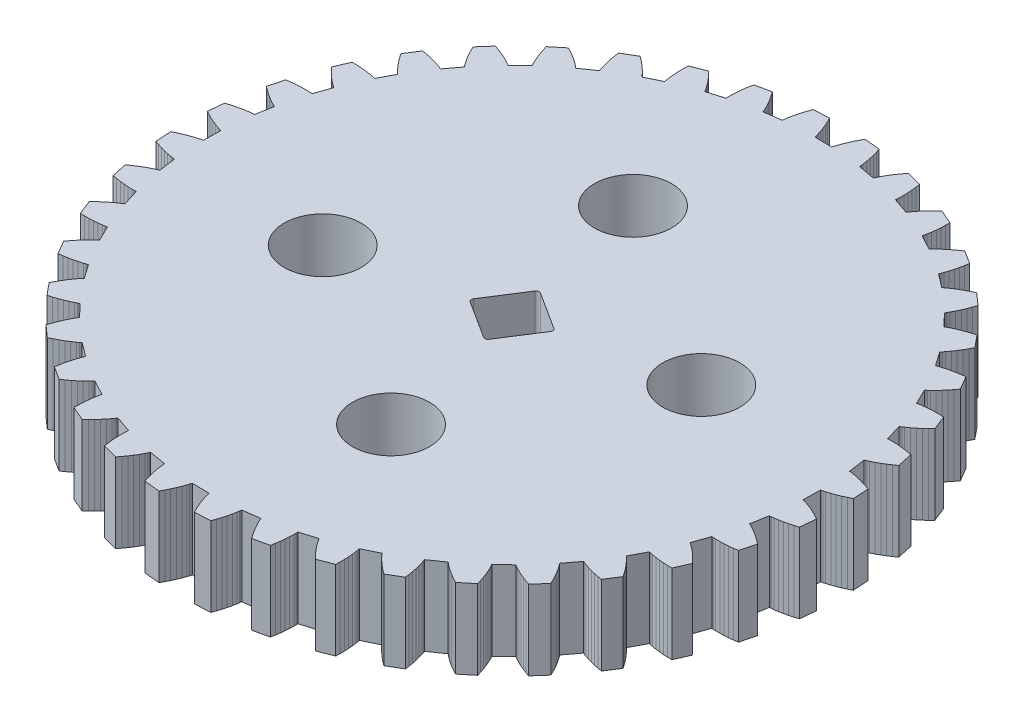
from build123d import *

# Parameters (mm, degrees)
BOSS_EXTRUDE2_DEPTH = 5
SKETCH4_R           = 2.425
CUT_EXTRUDE1_DEPTH  = 59.893978915


with BuildPart() as part:
    # Sketch2 → Boss-Extrude2 (new body)
    with BuildSketch(Plane(origin=(0, 0, 0), x_dir=(1, 0, 0), z_dir=(0, 1, 0))):
        Polygon((1.62446, 18.63357), (1.56046, 18.64093), (1.49637, 18.64925), (1.36792, 18.66858), (1.11018, 18.71715), (0.85152, 18.77769), (0.59219, 18.84922), (0.3324, 18.93102), (0.07232, 19.0226), (0.01335, 20.00933), (0.26067, 20.13123), (0.50888, 20.24339), (0.75784, 20.34529), (1.00744, 20.43621), (1.25757, 20.51513), (1.3828, 20.54962), (1.44545, 20.56552), (1.50812, 20.58044), (1.52832, 21.65214), (1.46626, 21.66942), (1.40425, 21.68766), (1.28042, 21.72685), (1.03344, 21.81514), (0.78744, 21.9154), (0.54249, 22.02661), (0.29869, 22.14805), (0.05614, 22.27918), (0.15226, 23.26299), (0.4156, 23.3447), (0.6783, 23.41666), (0.94014, 23.47835), (1.20089, 23.52911), (1.46029, 23.56792), (1.58937, 23.58241), (1.65373, 23.5883), (1.71796, 23.59324), (1.90557, 24.64858), (1.84697, 24.67536), (1.78859, 24.70308), (1.6724, 24.76116), (1.44228, 24.887), (1.21499, 25.02451), (0.99046, 25.17267), (0.76866, 25.33075), (0.54961, 25.49821), (0.79844, 26.45487), (1.07133, 26.49437), (1.34204, 26.52435), (1.61031, 26.54433), (1.87579, 26.55367), (2.13807, 26.55143), (2.26782, 26.54554), (2.33232, 26.54129), (2.39653, 26.53612), (2.74692, 27.54912), (2.69323, 27.58474), (2.6399, 27.62125), (2.53423, 27.69679), (2.32663, 27.85708), (2.12365, 28.02845), (1.92506, 28.20991), (1.73072, 28.40074), (1.54056, 28.60041), (1.93599, 29.50636), (2.21169, 29.50269), (2.48376, 29.48995), (2.75185, 29.46772), (3.01553, 29.43541), (3.27422, 29.39217), (3.40146, 29.36605), (3.4645, 29.35177), (3.52711, 29.33662), (4.03165, 30.28234), (3.9842, 30.32591), (3.93724, 30.37031), (3.84469, 30.46145), (3.66471, 30.65224), (3.49104, 30.85326), (3.32328, 31.06355), (3.16119, 31.28244), (3.00461, 31.50939), (3.53689, 32.34234), (3.80862, 32.29558), (4.07535, 32.24044), (4.33666, 32.17654), (4.59204, 32.10338), (4.84078, 32.0202), (4.96237, 31.9745), (5.0224, 31.95054), (5.08187, 31.92578), (5.72814, 32.78092), (5.68809, 32.83138), (5.64865, 32.88258), (5.5715, 32.98708), (5.42358, 33.20368), (5.2835, 33.42939), (5.1507, 33.66333), (5.02485, 33.90488), (4.90569, 34.15354), (5.56172, 34.89296), (5.8228, 34.80427), (6.07762, 34.70808), (6.32571, 34.60409), (6.5665, 34.49188), (6.79917, 34.37082), (6.91211, 34.30666), (6.96765, 34.2736), (7.02252, 34.23984), (7.79461, 34.98336), (7.76294, 35.03946), (7.732, 35.0962), (7.67214, 35.21148), (7.55993, 35.44855), (7.45688, 35.6934), (7.36232, 35.94524), (7.2758, 36.2035), (7.19701, 36.46773), (7.96063, 37.09542), (8.20462, 36.96699), (8.44125, 36.83212), (8.67003, 36.6906), (8.8903, 36.5421), (9.10117, 36.38613), (9.20268, 36.3051), (9.25236, 36.26375), (9.30127, 36.22183), (10.18017, 36.83541), (10.15767, 36.89577), (10.13598, 36.95666), (10.0949, 37.07988), (10.02116, 37.33159), (9.95768, 37.58954), (9.90367, 37.85307), (9.85862, 38.12169), (9.82214, 38.39499), (10.67455, 38.8955), (10.89544, 38.73048), (11.10806, 38.56025), (11.31188, 38.38468), (11.50621, 38.20356), (11.69008, 38.01652), (11.77767, 37.9206), (11.82027, 37.872), (11.86203, 37.82294), (12.82608, 38.29148), (12.81331, 38.35462), (12.80141, 38.41815), (12.78011, 38.54628), (12.74665, 38.80642), (12.7243, 39.07113), (12.71219, 39.33986), (12.70971, 39.61222), (12.71643, 39.88787), (13.63665, 40.24887), (13.82901, 40.05132), (14.01238, 39.84993), (14.18623, 39.64464), (14.34983, 39.43534), (14.50218, 39.22184), (14.57368, 39.11341), (14.60816, 39.05873), (14.64172, 39.00375), (15.6672, 39.3157), (15.66446, 39.38007), (15.66265, 39.44467), (15.66165, 39.57456), (15.6693, 39.83673), (15.68864, 40.10168), (15.71871, 40.369), (15.75887, 40.63839), (15.80863, 40.90959), (16.77399, 41.1222), (16.93308, 40.89699), (17.08269, 40.66939), (17.22228, 40.43943), (17.35113, 40.20712), (17.4682, 39.97242), (17.52186, 39.85413), (17.54736, 39.79474), (17.57191, 39.73518), (18.63357, 39.88287), (18.64093, 39.94687), (18.64925, 40.01097), (18.66858, 40.13941), (18.71715, 40.39716), (18.77769, 40.65582), (18.84922, 40.91514), (18.93102, 41.17494), (19.0226, 41.43502), (20.00933, 41.49398), (20.13123, 41.24666), (20.24339, 40.99846), (20.34529, 40.7495), (20.43621, 40.49989), (20.51513, 40.24976), (20.54962, 40.12454), (20.56552, 40.06189), (20.58044, 39.99922), (21.65214, 39.97902), (21.66942, 40.04108), (21.68766, 40.10308), (21.72685, 40.22692), (21.81514, 40.4739), (21.9154, 40.7199), (22.02661, 40.96484), (22.14805, 41.20864), (22.27918, 41.45119), (23.26299, 41.35508), (23.3447, 41.09173), (23.41666, 40.82904), (23.47835, 40.5672), (23.52911, 40.30645), (23.56792, 40.04705), (23.58241, 39.91797), (23.5883, 39.85361), (23.59324, 39.78937), (24.64858, 39.60177), (24.67536, 39.66036), (24.70308, 39.71875), (24.76116, 39.83493), (24.887, 40.06506), (25.02451, 40.29235), (25.17267, 40.51688), (25.33075, 40.73868), (25.49821, 40.95773), (26.45487, 40.70889), (26.49437, 40.43601), (26.52435, 40.16529), (26.54433, 39.89703), (26.55367, 39.63155), (26.55143, 39.36927), (26.54554, 39.23951), (26.54129, 39.17502), (26.53612, 39.11081), (27.54912, 38.76042), (27.58474, 38.8141), (27.62125, 38.86744), (27.69679, 38.9731), (27.85708, 39.18071), (28.02845, 39.38369), (28.20991, 39.58228), (28.40074, 39.77662), (28.60041, 39.96677), (29.50636, 39.57135), (29.50269, 39.29564), (29.48995, 39.02357), (29.46772, 38.75548), (29.43541, 38.49181), (29.39217, 38.23311), (29.36605, 38.10587), (29.35177, 38.04284), (29.33662, 37.98022), (30.28234, 37.47568), (30.32591, 37.52313), (30.37031, 37.5701), (30.46145, 37.66265), (30.65224, 37.84262), (30.85326, 38.01629), (31.06355, 38.18405), (31.28244, 38.34615), (31.50939, 38.50273), (32.34234, 37.97045), (32.29558, 37.69871), (32.24044, 37.43198), (32.17654, 37.17067), (32.10338, 36.9153), (32.0202, 36.66655), (31.9745, 36.54496), (31.95054, 36.48494), (31.92578, 36.42547), (32.78092, 35.77919), (32.83138, 35.81925), (32.88258, 35.85869), (32.98708, 35.93584), (33.20368, 36.08375), (33.42939, 36.22384), (33.66333, 36.35663), (33.90488, 36.48249), (34.15354, 36.60164), (34.89296, 35.94561), (34.80427, 35.68454), (34.70808, 35.42972), (34.60409, 35.18162), (34.49188, 34.94084), (34.37082, 34.70816), (34.30666, 34.59522), (34.2736, 34.53969), (34.23984, 34.48482), (34.98336, 33.71273), (35.03946, 33.74439), (35.0962, 33.77534), (35.21148, 33.83519), (35.44855, 33.9474), (35.6934, 34.05045), (35.94524, 34.14502), (36.2035, 34.23154), (36.46773, 34.31033), (37.09542, 33.5467), (36.96699, 33.30271), (36.83212, 33.06608), (36.6906, 32.83731), (36.5421, 32.61704), (36.38613, 32.40617), (36.3051, 32.30466), (36.26375, 32.25497), (36.22183, 32.20606), (36.83541, 31.32717), (36.89577, 31.34967), (36.95666, 31.37135), (37.07988, 31.41244), (37.33159, 31.48618), (37.58954, 31.54966), (37.85307, 31.60366), (38.12169, 31.64872), (38.39499, 31.6852), (38.8955, 30.83279), (38.73048, 30.61189), (38.56025, 30.39927), (38.38468, 30.19545), (38.20356, 30.00113), (38.01652, 29.81725), (37.9206, 29.72966), (37.872, 29.68706), (37.82294, 29.64531), (38.29148, 28.68125), (38.35462, 28.69403), (38.41815, 28.70593), (38.54628, 28.72723), (38.80642, 28.76069), (39.07113, 28.78303), (39.33986, 28.79515), (39.61222, 28.79763), (39.88787, 28.7909), (40.24887, 27.87069), (40.05132, 27.67833), (39.84993, 27.49496), (39.64464, 27.32111), (39.43534, 27.15751), (39.22184, 27.00516), (39.11341, 26.93365), (39.05873, 26.89918), (39.00375, 26.86562), (39.3157, 25.84013), (39.38007, 25.84288), (39.44467, 25.84469), (39.57456, 25.84568), (39.83673, 25.83803), (40.10168, 25.8187), (40.369, 25.78862), (40.63839, 25.74846), (40.90959, 25.6987), (41.1222, 24.73334), (40.89699, 24.57426), (40.66939, 24.42465), (40.43943, 24.28506), (40.20712, 24.15621), (39.97242, 24.03913), (39.85413, 23.98547), (39.79474, 23.95998), (39.73518, 23.93543), (39.88287, 22.87377), (39.94687, 22.86641), (40.01097, 22.85809), (40.13941, 22.83875), (40.39716, 22.79019), (40.65582, 22.72964), (40.91514, 22.65812), (41.17494, 22.57631), (41.43502, 22.48474), (41.49398, 21.49801), (41.24666, 21.37611), (40.99846, 21.26395), (40.7495, 21.16205), (40.49989, 21.07113), (40.24976, 20.99221), (40.12454, 20.95771), (40.06189, 20.94182), (39.99922, 20.92689), (39.97902, 19.8552), (40.04108, 19.83792), (40.10308, 19.81968), (40.22692, 19.78048), (40.4739, 19.6922), (40.7199, 19.59193), (40.96484, 19.48072), (41.20864, 19.35928), (41.45119, 19.22815), (41.35508, 18.24434), (41.09173, 18.16264), (40.82904, 18.09068), (40.5672, 18.02898), (40.30645, 17.97823), (40.04705, 17.93941), (39.91797, 17.92493), (39.85361, 17.91903), (39.78937, 17.91409), (39.60177, 16.85875), (39.66036, 16.83198), (39.71875, 16.80426), (39.83493, 16.74618), (40.06506, 16.62034), (40.29235, 16.48283), (40.51688, 16.33467), (40.73868, 16.17659), (40.95773, 16.00913), (40.70889, 15.05247), (40.43601, 15.01296), (40.16529, 14.98299), (39.89703, 14.96301), (39.63155, 14.95367), (39.36927, 14.95591), (39.23951, 14.9618), (39.17502, 14.96604), (39.11081, 14.97121), (38.76042, 13.95821), (38.8141, 13.9226), (38.86744, 13.88609), (38.9731, 13.81055), (39.18071, 13.65026), (39.38369, 13.47889), (39.58228, 13.29743), (39.77662, 13.10659), (39.96677, 12.90693), (39.57135, 12.00097), (39.29564, 12.00464), (39.02357, 12.01739), (38.75548, 12.03962), (38.49181, 12.07193), (38.23311, 12.11517), (38.10587, 12.14128), (38.04284, 12.15556), (37.98022, 12.17071), (37.47568, 11.225), (37.52313, 11.18143), (37.5701, 11.13702), (37.66265, 11.04588), (37.84262, 10.85509), (38.01629, 10.65408), (38.18405, 10.44378), (38.34615, 10.2249), (38.50273, 9.99794), (37.97045, 9.165), (37.69871, 9.21175), (37.43198, 9.2669), (37.17067, 9.3308), (36.9153, 9.40396), (36.66655, 9.48713), (36.54496, 9.53283), (36.48494, 9.5568), (36.42547, 9.58156), (35.77919, 8.72641), (35.81925, 8.67596), (35.85869, 8.62475), (35.93584, 8.52026), (36.08375, 8.30366), (36.22384, 8.07795), (36.35663, 7.844), (36.48249, 7.60246), (36.60164, 7.3538), (35.94561, 6.61438), (35.68454, 6.70307), (35.42972, 6.79926), (35.18162, 6.90325), (34.94084, 7.01546), (34.70816, 7.13652), (34.59522, 7.20068), (34.53969, 7.23374), (34.48482, 7.2675), (33.71273, 6.52398), (33.74439, 6.46788), (33.77534, 6.41113), (33.83519, 6.29586), (33.9474, 6.05878), (34.05045, 5.81394), (34.14502, 5.5621), (34.23154, 5.30384), (34.31033, 5.03961), (33.5467, 4.41191), (33.30271, 4.54035), (33.06608, 4.67522), (32.83731, 4.81674), (32.61704, 4.96523), (32.40617, 5.12121), (32.30466, 5.20224), (32.25497, 5.24358), (32.20606, 5.28551), (31.32717, 4.67193), (31.34967, 4.61156), (31.37135, 4.55068), (31.41244, 4.42745), (31.48618, 4.17575), (31.54966, 3.9178), (31.60366, 3.65426), (31.64872, 3.38565), (31.6852, 3.11234), (30.83279, 2.61183), (30.61189, 2.77686), (30.39927, 2.94709), (30.19545, 3.12265), (30.00113, 3.30378), (29.81725, 3.49082), (29.72966, 3.58673), (29.68706, 3.63534), (29.64531, 3.6844), (28.68125, 3.21586), (28.69403, 3.15272), (28.70593, 3.08919), (28.72723, 2.96106), (28.76069, 2.70092), (28.78303, 2.43621), (28.79515, 2.16747), (28.79763, 1.89512), (28.7909, 1.61947), (27.87069, 1.25847), (27.67833, 1.45602), (27.49496, 1.65741), (27.32111, 1.8627), (27.15751, 2.07199), (27.00516, 2.28549), (26.93365, 2.39393), (26.89918, 2.4486), (26.86562, 2.50359), (25.84013, 2.19163), (25.84288, 2.12727), (25.84469, 2.06266), (25.84568, 1.93277), (25.83803, 1.6706), (25.8187, 1.40566), (25.78862, 1.13834), (25.74846, 0.86894), (25.6987, 0.59774), (24.73334, 0.38514), (24.57426, 0.61035), (24.42465, 0.83795), (24.28506, 1.0679), (24.15621, 1.30021), (24.03913, 1.53492), (23.98547, 1.65321), (23.95998, 1.7126), (23.93543, 1.77216), (22.87377, 1.62446), (22.86641, 1.56046), (22.85809, 1.49637), (22.83875, 1.36792), (22.79019, 1.11018), (22.72964, 0.85152), (22.65812, 0.59219), (22.57631, 0.3324), (22.48474, 0.07232), (21.49801, 0.01335), (21.37611, 0.26067), (21.26395, 0.50888), (21.16205, 0.75784), (21.07113, 1.00744), (20.99221, 1.25757), (20.95771, 1.3828), (20.94182, 1.44545), (20.92689, 1.50812), (19.8552, 1.52832), (19.83792, 1.46626), (19.81968, 1.40425), (19.78048, 1.28042), (19.6922, 1.03344), (19.59193, 0.78744), (19.48072, 0.54249), (19.35928, 0.29869), (19.22815, 0.05614), (18.24434, 0.15226), (18.16264, 0.4156), (18.09068, 0.6783), (18.02898, 0.94014), (17.97823, 1.20089), (17.93941, 1.46029), (17.92493, 1.58937), (17.91903, 1.65373), (17.91409, 1.71796), (16.85875, 1.90557), (16.83198, 1.84697), (16.80426, 1.78859), (16.74618, 1.6724), (16.62034, 1.44228), (16.48283, 1.21499), (16.33467, 0.99046), (16.17659, 0.76866), (16.00913, 0.54961), (15.05247, 0.79844), (15.01296, 1.07133), (14.98299, 1.34204), (14.96301, 1.61031), (14.95367, 1.87579), (14.95591, 2.13807), (14.9618, 2.26782), (14.96604, 2.33232), (14.97121, 2.39653), (13.95821, 2.74692), (13.9226, 2.69323), (13.88609, 2.6399), (13.81055, 2.53423), (13.65026, 2.32663), (13.47889, 2.12365), (13.29743, 1.92506), (13.10659, 1.73072), (12.90693, 1.54056), (12.00097, 1.93599), (12.00464, 2.21169), (12.01739, 2.48376), (12.03962, 2.75185), (12.07193, 3.01553), (12.11517, 3.27422), (12.14128, 3.40146), (12.15556, 3.4645), (12.17071, 3.52711), (11.225, 4.03165), (11.18143, 3.9842), (11.13702, 3.93724), (11.04588, 3.84469), (10.85509, 3.66471), (10.65408, 3.49104), (10.44378, 3.32328), (10.2249, 3.16119), (9.99794, 3.00461), (9.165, 3.53689), (9.21175, 3.80862), (9.2669, 4.07535), (9.3308, 4.33666), (9.40396, 4.59204), (9.48713, 4.84078), (9.53283, 4.96237), (9.5568, 5.0224), (9.58156, 5.08187), (8.72641, 5.72814), (8.67596, 5.68809), (8.62475, 5.64865), (8.52026, 5.5715), (8.30366, 5.42358), (8.07795, 5.2835), (7.844, 5.1507), (7.60246, 5.02485), (7.3538, 4.90569), (6.61438, 5.56172), (6.70307, 5.8228), (6.79926, 6.07762), (6.90325, 6.32571), (7.01546, 6.5665), (7.13652, 6.79917), (7.20068, 6.91211), (7.23374, 6.96765), (7.2675, 7.02252), (6.52398, 7.79461), (6.46788, 7.76294), (6.41113, 7.732), (6.29586, 7.67214), (6.05878, 7.55993), (5.81394, 7.45688), (5.5621, 7.36232), (5.30384, 7.2758), (5.03961, 7.19701), (4.41191, 7.96063), (4.54035, 8.20462), (4.67522, 8.44125), (4.81674, 8.67003), (4.96523, 8.8903), (5.12121, 9.10117), (5.20224, 9.20268), (5.24358, 9.25236), (5.28551, 9.30127), (4.67193, 10.18017), (4.61156, 10.15767), (4.55068, 10.13598), (4.42745, 10.0949), (4.17575, 10.02116), (3.9178, 9.95768), (3.65426, 9.90367), (3.38565, 9.85862), (3.11234, 9.82214), (2.61183, 10.67455), (2.77686, 10.89544), (2.94709, 11.10806), (3.12265, 11.31188), (3.30378, 11.50621), (3.49082, 11.69008), (3.58673, 11.77767), (3.63534, 11.82027), (3.6844, 11.86203), (3.21586, 12.82608), (3.15272, 12.81331), (3.08919, 12.80141), (2.96106, 12.78011), (2.70092, 12.74665), (2.43621, 12.7243), (2.16747, 12.71219), (1.89512, 12.70971), (1.61947, 12.71643), (1.25847, 13.63665), (1.45602, 13.82901), (1.65741, 14.01238), (1.8627, 14.18623), (2.07199, 14.34983), (2.28549, 14.50218), (2.39393, 14.57368), (2.4486, 14.60816), (2.50359, 14.64172), (2.19163, 15.6672), (2.12727, 15.66446), (2.06266, 15.66265), (1.93277, 15.66165), (1.6706, 15.6693), (1.40566, 15.68864), (1.13834, 15.71871), (0.86894, 15.75887), (0.59774, 15.80863), (0.38514, 16.77399), (0.61035, 16.93308), (0.83795, 17.08269), (1.0679, 17.22228), (1.30021, 17.35113), (1.53492, 17.4682), (1.65321, 17.52186), (1.7126, 17.54736), (1.77216, 17.57191), align=None)
    extrude(amount=BOSS_EXTRUDE2_DEPTH)

    # Sketch4 → Cut-Extrude1 (cut, through all)
    with BuildSketch(Plane.XZ):
        with Locations(Location((22.904427445, -10.98769461, 0), (0, 0, 270))):
            Circle(SKETCH4_R)
        with Locations(Location((30.51963789, -22.904429945, 0), (0, 0, 270))):
            Circle(SKETCH4_R)
        with Locations(Location((18.602902555, -30.51964039, 0), (0, 0, 270))):
            Circle(SKETCH4_R)
        with Locations(Location((10.98769211, -18.602905055, 0), (0, 0, 270))):
            Circle(SKETCH4_R)
        with BuildLine():
            Line((21.071799164, -18.651575548), (18.712406008, -20.159310251))
            ThreePointArc((18.712406008, -20.159310251), (18.624781891, -20.284823086), (18.651573261, -20.435533669))
            Line((18.651573261, -20.435533669), (20.159307964, -22.794926826))
            ThreePointArc((20.159307964, -22.794926826), (20.284820799, -22.882550942), (20.435531382, -22.855759572))
            Line((20.435531382, -22.855759572), (22.794924538, -21.348024869))
            ThreePointArc((22.794924538, -21.348024869), (22.882548655, -21.222512035), (22.855757285, -21.071801451))
            Line((22.855757285, -21.071801451), (21.348022582, -18.712408295))
            ThreePointArc((21.348022582, -18.712408295), (21.222509747, -18.624784178), (21.071799164, -18.651575548))
        make_face()
    extrude(amount=-CUT_EXTRUDE1_DEPTH, mode=Mode.SUBTRACT)


solid = part.part
